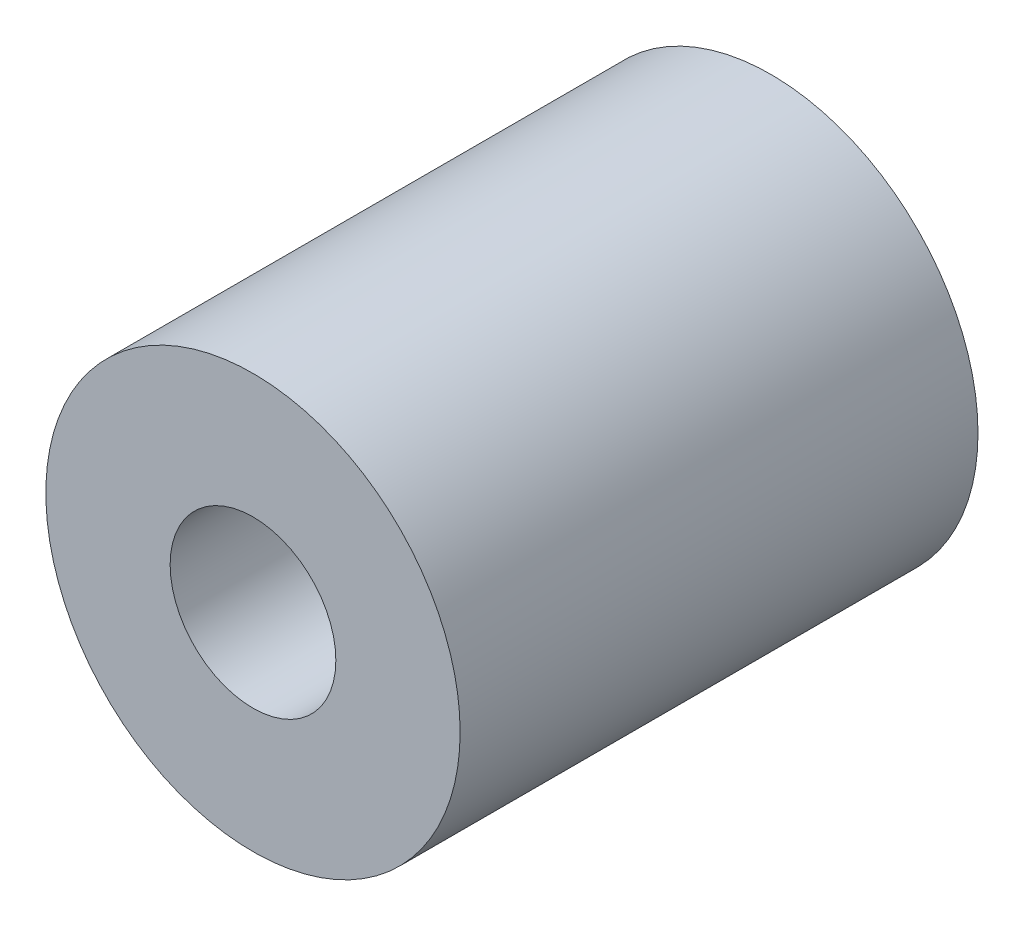
from build123d import *

# Parameters (mm, degrees)
SKETCH_1_R          = 10
EXTRUDE_1_DEPTH     = 25
SKETCH_3_R          = 4
CUT_EXTRUDE_1_DEPTH = 7.5
SKETCH_4_R          = 5
CUT_EXTRUDE_2_DEPTH = 12.5
SKETCH_5_R          = 4
CUT_EXTRUDE_3_DEPTH = 23.5


with BuildPart() as part:
    # 草图1 → 凸台-拉伸1 (new body)
    with BuildSketch(Plane.XY):
        Circle(SKETCH_1_R)
    extrude(amount=EXTRUDE_1_DEPTH)

    # 草图3 → 切除-拉伸1 (cut)
    with BuildSketch(Plane.XY.offset(25)):
        Circle(SKETCH_3_R)
    extrude(amount=-CUT_EXTRUDE_1_DEPTH, mode=Mode.SUBTRACT)

    # 草图4 → 切除-拉伸2 (cut)
    with BuildSketch(Plane(origin=(0, 0, 0), x_dir=(-1, 0, 0), z_dir=(0, 0, -1))):
        Circle(SKETCH_4_R)
    extrude(amount=-CUT_EXTRUDE_2_DEPTH, mode=Mode.SUBTRACT)

    # 草图5 → 切除-拉伸3 (cut, through all)
    with BuildSketch(Plane.XY.offset(17.5)):
        Circle(SKETCH_5_R)
    extrude(amount=-CUT_EXTRUDE_3_DEPTH, mode=Mode.SUBTRACT)


solid = part.part
